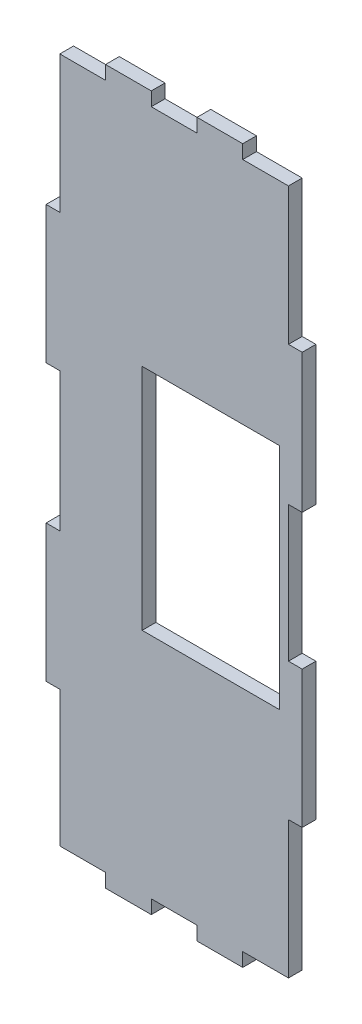
from build123d import *

# Parameters (mm, degrees)
ESBO_O1_W                = 30
ESBO_O1_H                = 50
RESSALTO_EXTRUS_O1_DEPTH = 3


with BuildPart() as part:
    # Esboço1 → Ressalto-extrusão1 (new body)
    with BuildSketch(Plane.XY):
        Polygon((-0.617519042, -25.482947615), (-0.617519042, -55.805708704), (-3.617519042, -55.805708704), (-3.617519042, -85.805708704), (-0.617519042, -85.805708704), (-0.617519042, -115.482947615), (9.382480958, -115.482947615), (9.382480958, -118.482947615), (19.382480958, -118.482947615), (19.382480958, -115.482947615), (29.382480958, -115.482947615), (29.382480958, -118.482947615), (39.382480958, -118.482947615), (39.382480958, -115.482947615), (49.382480958, -115.482947615), (49.382480958, -85.482947615), (52.382480958, -85.482947615), (52.382480958, -55.482947615), (49.382480958, -55.482947615), (49.382480958, -25.805708704), (52.382480958, -25.805708704), (52.382480958, 4.517052385), (49.382480958, 4.517052385), (49.382480958, 34.517052385), (39.382480958, 34.517052385), (39.382480958, 37.517052385), (29.382480958, 37.517052385), (29.382480958, 34.517052385), (19.382480958, 34.517052385), (19.382480958, 37.517052385), (9.382480958, 37.517052385), (9.382480958, 34.517052385), (-0.617519042, 34.517052385), (-0.617519042, 4.517052385), (-3.617519042, 4.517052385), (-3.617519042, -25.482947615), align=None)
        with Locations((32.382480958, -40.64432816)):
            Rectangle(ESBO_O1_W, ESBO_O1_H, mode=Mode.SUBTRACT)
    extrude(amount=RESSALTO_EXTRUS_O1_DEPTH)


solid = part.part
